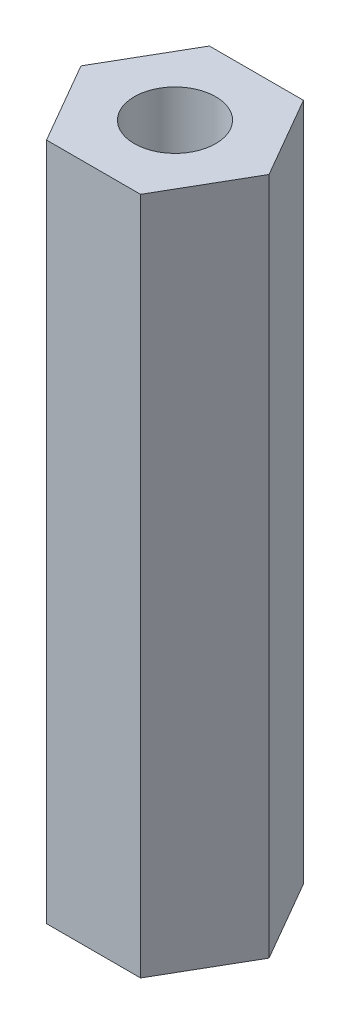
from build123d import *

# Parameters (mm, degrees)
SKETCH1_R           = 1.5
BOSS_EXTRUDE1_DEPTH = 25


with BuildPart() as part:
    # Sketch1 → Boss-Extrude1 (new body)
    with BuildSketch(Plane(origin=(0, 0, 0), x_dir=(1, 0, 0), z_dir=(0, 1, 0))):
        Polygon((-1.732050808, 3), (-3.464101615, 0), (-1.732050808, -3), (1.732050808, -3), (3.464101615, 0), (1.732050808, 3), align=None)
        with Locations(Location((0, 0, 0), (0, 0, 270))):
            Circle(SKETCH1_R, mode=Mode.SUBTRACT)
    extrude(amount=BOSS_EXTRUDE1_DEPTH)


solid = part.part
